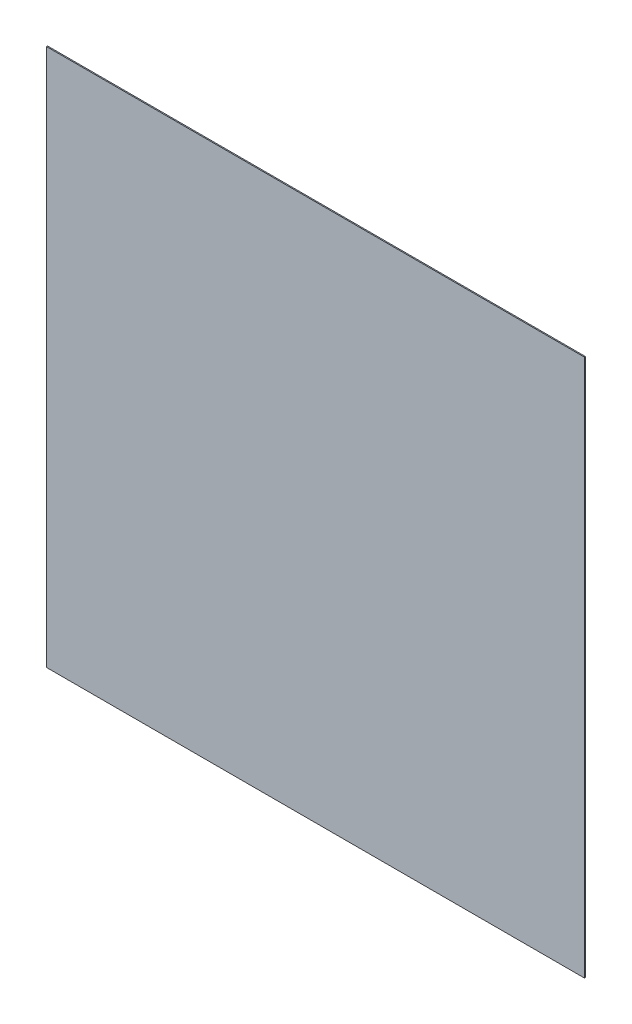
from build123d import *

# Parameters (mm, degrees)
SKETCH1_W           = 2500
SKETCH1_H           = 2500
BOSS_EXTRUDE1_DEPTH = 5


with BuildPart() as part:
    # Sketch1 → Boss-Extrude1 (new body)
    with BuildSketch(Plane.XY):
        Rectangle(SKETCH1_W, SKETCH1_H)
    extrude(amount=BOSS_EXTRUDE1_DEPTH)


solid = part.part
